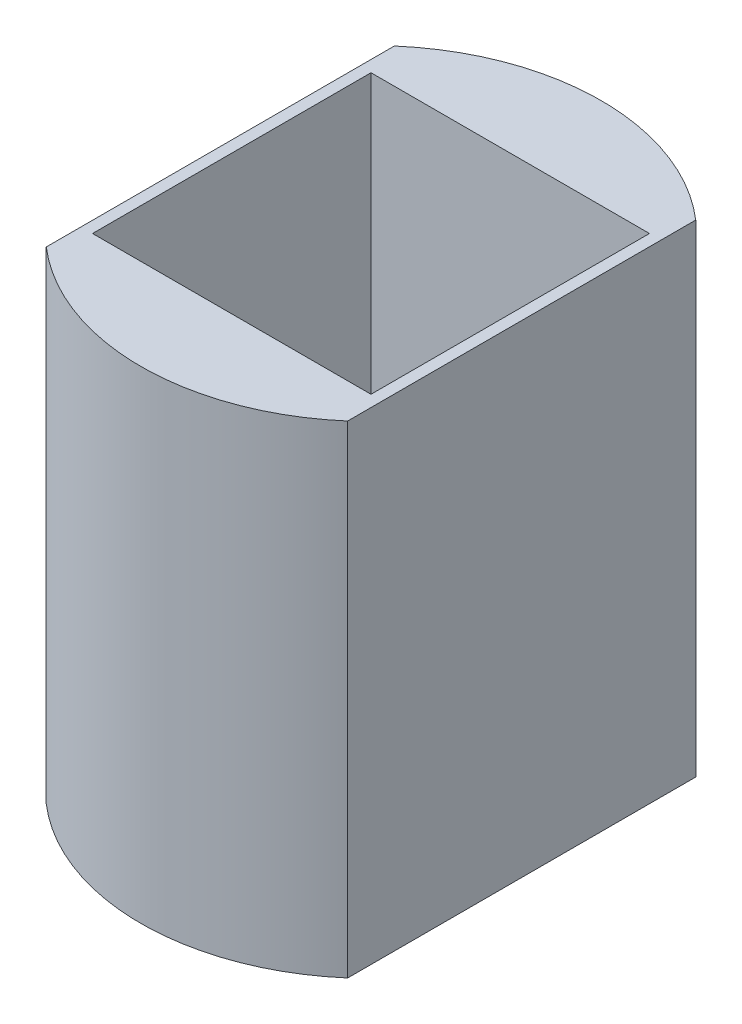
from build123d import *

# Parameters (mm, degrees)
SKETCH1_W           = 6.873579398
SKETCH1_H           = 7.9375
BOSS_EXTRUDE1_DEPTH = 1
SKETCH2_W           = 6.35
SKETCH2_H           = 6.35
BOSS_EXTRUDE2_DEPTH = 10


with BuildPart() as part:
    # Sketch1 → Boss-Extrude1 (new body)
    with BuildSketch(Plane(origin=(0, 0, 0), x_dir=(1, 0, 0), z_dir=(0, 1, 0))):
        Rectangle(SKETCH1_W, SKETCH1_H)
        with BuildLine():
            ThreePointArc((3.436789699, 3.96875), (0, 5.25), (-3.436789699, 3.96875))
            Line((-3.436789699, 3.96875), (3.436789699, 3.96875))
        make_face()
        with BuildLine():
            Line((3.436789699, -3.96875), (-3.436789699, -3.96875))
            ThreePointArc((-3.436789699, -3.96875), (0, -5.25), (3.436789699, -3.96875))
        make_face()
    extrude(amount=BOSS_EXTRUDE1_DEPTH)

    # Sketch2 → Boss-Extrude2 (add)
    with BuildSketch(Plane(origin=(0, 1, 0), x_dir=(1, 0, 0), z_dir=(0, 1, 0))):
        with BuildLine():
            Line((-3.436789699, 3.96875), (-3.436789699, -3.96875))
            ThreePointArc((-3.436789699, -3.96875), (0, -5.25), (3.436789699, -3.96875))
            Line((3.436789699, -3.96875), (3.436789699, 3.96875))
            ThreePointArc((3.436789699, 3.96875), (0, 5.25), (-3.436789699, 3.96875))
        make_face()
        Rectangle(SKETCH2_W, SKETCH2_H, mode=Mode.SUBTRACT)
    extrude(amount=BOSS_EXTRUDE2_DEPTH)


solid = part.part
